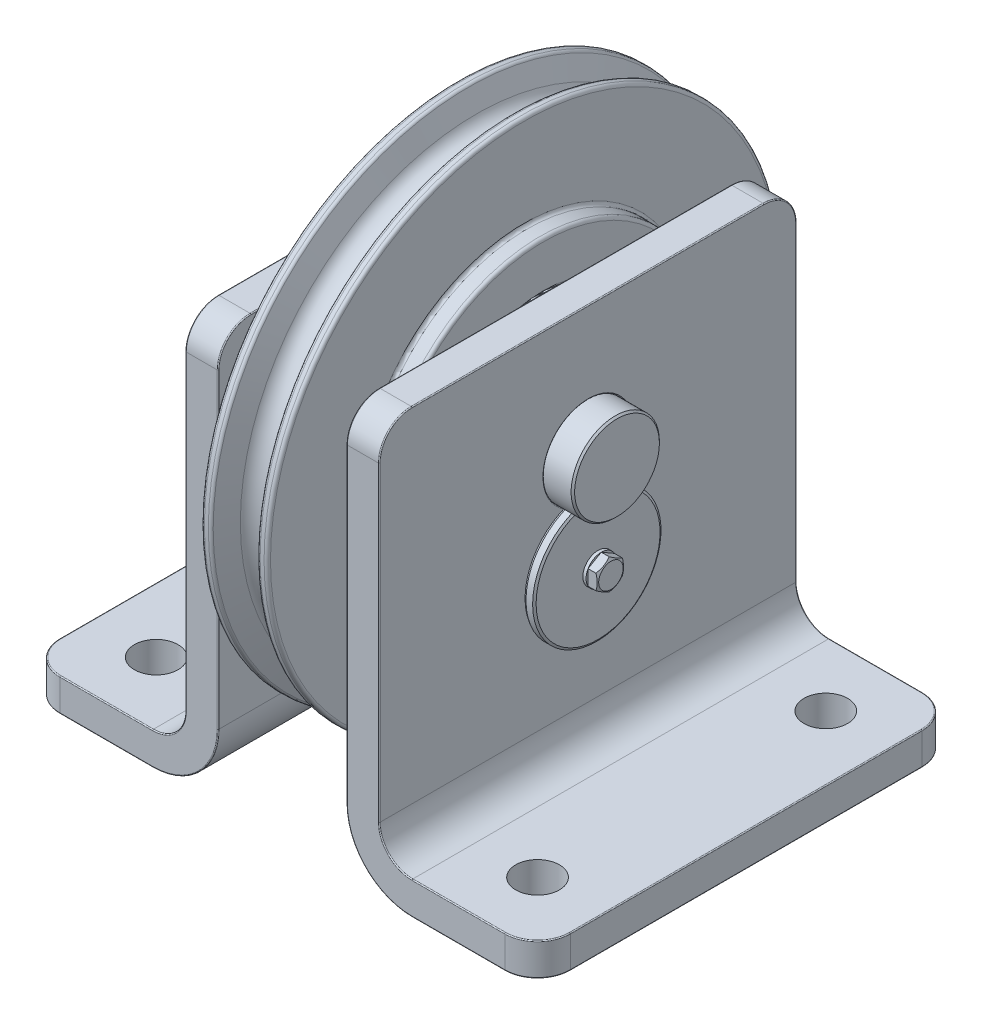
from build123d import *
from OCP.BRepFilletAPI import BRepFilletAPI_MakeChamfer

# Parameters (mm, degrees)
SKETCH5_R                       = 44.7675
CUT_EXTRUDE1_DEPTH              = 150.530082605
BOSS_EXTRUDE1_REACH             = 147.168
SKETCH6_R                       = 44.7675
BOSS_EXTRUDE1_DIRECTION_2_REACH = 147.168
BOSS_EXTRUDE2_DEPTH             = 82.55
BOSS_EXTRUDE2_DEPTH_BACK        = 82.55
FILLET1_R                       = 12.954
SKETCH8_R                       = 8.636
CUT_EXTRUDE2_DEPTH              = 247.537881116
SKETCH9_R                       = 33.866666667
BOSS_EXTRUDE3_DEPTH             = 4.699
SKETCH10_R                      = 17.4625
CUT_EXTRUDE3_DEPTH              = 164.676001653
SKETCH11_R                      = 17.4625
BOSS_EXTRUDE4_DEPTH             = 49.8602
SKETCH12_R                      = 25.4
BOSS_EXTRUDE5_DEPTH             = 4.0132
SKETCH13_W                      = 50.8
SKETCH13_H                      = 50.8
CUT_EXTRUDE4_DEPTH              = 4.0132
SKETCH14_R                      = 6.0325
BOSS_EXTRUDE6_DEPTH             = 1.27
BOSS_EXTRUDE7_DEPTH             = 3.81
SKETCH16_OUTSIDE_W              = 897.842
SKETCH16_OUTSIDE_H              = 908.256
SKETCH16_OUTSIDE_R              = 4.843298248
CUT_EXTRUDE5_DEPTH              = 180.82888058
CUT_EXTRUDE5_DRAFT              = -60
CHAMFER1_SIZE                   = 0.6985
SKETCH17_R                      = 1.27
CUT_EXTRUDE6_DEPTH              = 24.4602
CHAMFER2_SIZE                   = 0.508
CHAMFER2_SIZE2                  = 0.87988181
FILLET2_R                       = 0.381
CHAMFER3_SIZE                   = 0.254
CHAMFER3_SIZE2                  = 0.439940905
FILLET3_R                       = 1.27
CHAMFER4_SIZE                   = 0.508


with BuildPart() as part:
    # Sketch4 → Revolve1 (revolve)
    with BuildSketch(Plane.XY, mode=Mode.PRIVATE) as revolve1_sk:
        with BuildLine():
            Line((-13.081, 101.6), (-13.081, 64.0842))
            Line((-13.081, 64.0842), (-20.701, 64.0842))
            Line((-20.701, 64.0842), (-20.701, 0))
            Line((-20.701, 0), (20.701, 0))
            Line((20.701, 0), (20.701, 64.0842))
            Line((20.701, 64.0842), (13.081, 64.0842))
            Line((13.081, 64.0842), (13.081, 101.6))
            Line((13.081, 101.6), (9.41578, 101.6))
            Line((9.41578, 101.6), (5.821645932, 93.349070458))
            ThreePointArc((5.821645932, 93.349070458), (0, 89.535), (-5.821645932, 93.349070458))
            Line((-5.821645932, 93.349070458), (-9.41578, 101.6))
            Line((-9.41578, 101.6), (-13.081, 101.6))
        make_face()
    revolve(revolve1_sk.sketch.rotate(Axis((-20.701, 0, 0), (1, 0, 0)), 90), axis=Axis((-20.701, 0, 0), (1, 0, 0)))

    # Sketch5 → Cut-Extrude1 (cut, through all)
    with BuildSketch(Plane.ZY.offset(20.701)):
        Circle(SKETCH5_R)
    extrude(amount=-CUT_EXTRUDE1_DEPTH, mode=Mode.SUBTRACT)


with BuildPart() as body_2:

    # Boss-Extrude1: up to this face of the body (flat: up to its plane)
    boss_extrude1_end = Plane(part.part.faces().sort_by_distance((-20.701, 0, -62.271625105))[0])
    # Sketch6 → Boss-Extrude1 (new, up to the picked face)
    with BuildSketch(Plane(origin=(0, 0, 0), x_dir=(0, 0, -1), z_dir=(1, 0, 0)), mode=Mode.PRIVATE) as boss_extrude1_sk1:
        Circle(SKETCH6_R)
    boss_extrude1_tool1 = split(extrude(boss_extrude1_sk1.sketch, amount=-BOSS_EXTRUDE1_REACH, mode=Mode.PRIVATE), bisect_by=boss_extrude1_end, keep=Keep.BOTH, mode=Mode.PRIVATE)
    add(boss_extrude1_tool1.solids().sort_by(Axis((0, 0, 0), (-1, 0, 0)))[0])


    # Boss-Extrude1 direction 2: up to this face of the body (flat: up to its plane)
    boss_extrude1_direction_2_end = Plane(part.part.faces().sort_by_distance((20.701, 0, -62.271625105))[0])
    # Sketch6 → Boss-Extrude1 direction 2 (add, up to the picked face)
    with BuildSketch(Plane(origin=(0, 0, 0), x_dir=(0, 0, -1), z_dir=(1, 0, 0)), mode=Mode.PRIVATE) as boss_extrude1_direction_2_sk1:
        Circle(SKETCH6_R)
    boss_extrude1_direction_2_tool1 = split(extrude(boss_extrude1_direction_2_sk1.sketch, amount=BOSS_EXTRUDE1_DIRECTION_2_REACH, mode=Mode.PRIVATE), bisect_by=boss_extrude1_direction_2_end, keep=Keep.BOTH, mode=Mode.PRIVATE)
    add(boss_extrude1_direction_2_tool1.solids().sort_by(Axis((0, 0, 0), (1, 0, 0)))[0])


with BuildPart() as body_3:
    # Sketch7 → Boss-Extrude2 (new, two sides: drawn at the far end of the back side and taken through both)
    with BuildSketch(Plane.XY.offset(-BOSS_EXTRUDE2_DEPTH_BACK)):
        with BuildLine():
            Line((-25.4, 49.911), (-25.4, -86.106))
            ThreePointArc((-25.4, -86.106), (-32.988277513, -104.425722487), (-51.308, -112.014))
            Line((-51.308, -112.014), (-100.965, -112.014))
            Line((-100.965, -112.014), (-100.965, -99.06))
            Line((-100.965, -99.06), (-51.308, -99.06))
            ThreePointArc((-51.308, -99.06), (-42.148138757, -95.265861243), (-38.354, -86.106))
            Line((-38.354, -86.106), (-38.354, 49.911))
            Line((-38.354, 49.911), (-25.4, 49.911))
        make_face()
    extrude(amount=BOSS_EXTRUDE2_DEPTH + BOSS_EXTRUDE2_DEPTH_BACK)

    # Fillet1
    fillet1_edges = [body_3.edges().sort_by_distance(p)[0] for p in [
        (-100.965, -105.537, 82.55),
        (-31.877, 49.911, -82.55),
        (-100.965, -105.537, -82.55),
        (-31.877, 49.911, 82.55),
    ]]
    fillet(fillet1_edges, radius=FILLET1_R)

    # Sketch8 → Cut-Extrude2 (cut, through all)
    with BuildSketch(Plane(origin=(0, -99.06, 0), x_dir=(1, 0, 0), z_dir=(0, 1, 0))):
        with Locations(Location((-75.438, -57.023, 0), (0, 0, 270))):
            Circle(SKETCH8_R)
        with Locations(Location((-75.438, 57.023, 0), (0, 0, 270))):
            Circle(SKETCH8_R)
    extrude(amount=-CUT_EXTRUDE2_DEPTH, mode=Mode.SUBTRACT)


with BuildPart() as body_4:
    # Sketch9 → Boss-Extrude3 (new body)
    with BuildSketch(Plane.ZY.offset(20.701)):
        with Locations(Location((0, 0, 0), (0, 0, 270))):
            Circle(SKETCH9_R)
    extrude(amount=BOSS_EXTRUDE3_DEPTH)


with BuildPart() as cut_extrude3_tool:
    # Sketch10 → Cut-Extrude3 (new, through all)
    with BuildSketch(Plane.ZY.offset(38.354)):
        Circle(SKETCH10_R)
    extrude(amount=-CUT_EXTRUDE3_DEPTH)


with BuildPart() as body_2_1:
    add(body_2.part)

    # Cut-Extrude3: cut by cut_extrude3_tool
    add(cut_extrude3_tool.part, mode=Mode.SUBTRACT)

    # Chamfer4
    chamfer4_edges = [body_2_1.edges().sort_by_distance(p)[0] for p in [
        (-20.701, 0, 44.7675),
        (20.701, 0, 44.7675),
    ]]
    chamfer(chamfer4_edges, length=CHAMFER4_SIZE)


with BuildPart() as body_3_1:
    add(body_3.part)

    # Cut-Extrude3: cut by cut_extrude3_tool
    add(cut_extrude3_tool.part, mode=Mode.SUBTRACT)

    # Fillet2
    fillet2_edges = [body_3_1.edges().sort_by_distance(p)[0] for p in [
        (-42.148138757, -95.265861243, 82.55),
        (-69.6595, -99.06, 82.55),
        (-25.4, -24.5745, -82.55),
        (-32.988277513, -104.425722487, -82.55),
        (-69.6595, -99.06, -82.55),
        (-32.988277513, -104.425722487, 82.55),
        (-42.148138757, -95.265861243, -82.55),
        (-25.4, -24.5745, 82.55),
        (-100.965, -99.06, 0),
        (-100.965, -112.014, 0),
        (-69.6595, -112.014, -82.55),
        (-69.6595, -112.014, 82.55),
        (-97.170861243, -112.014, 78.755861243),
        (-97.170861243, -112.014, -78.755861243),
        (-38.354, -24.5745, -82.55),
        (-97.170861243, -99.06, 78.755861243),
        (-97.170861243, -99.06, -78.755861243),
        (-38.354, -24.5745, 82.55),
        (-38.354, 49.911, 0),
        (-38.354, 46.116861243, -78.755861243),
        (-38.354, 46.116861243, 78.755861243),
        (-25.4, 49.911, 0),
        (-25.4, 46.116861243, -78.755861243),
        (-25.4, 46.116861243, 78.755861243),
        (-38.354, 0, -17.4625),
    ]]
    fillet(fillet2_edges, radius=FILLET2_R)


with BuildPart() as body_4_1:
    add(body_4.part)

    # Cut-Extrude3: cut by cut_extrude3_tool
    add(cut_extrude3_tool.part, mode=Mode.SUBTRACT)

    # Chamfer3: one chamfer whose edges measure the first distance from different faces: ONE call of the kernel's chamfer builder (chamfer() names one face for all edges)
    chamfer3_edges_1 = [body_4_1.edges().sort_by_distance(p)[0] for p in [
        (-20.701, 33.866666667, 0),
    ]]
    chamfer3_side_1 = [body_4_1.faces().sort_by_distance(p)[0] for p in [
        (-20.701, 32.90877268, 0),
    ]]
    chamfer3_edges_2 = [body_4_1.edges().sort_by_distance(p)[0] for p in [
        (-25.4, 33.866666667, 0),
    ]]
    chamfer3_side_2 = [body_4_1.faces().sort_by_distance(p)[0] for p in [
        (-23.0505, 33.866666667, 0),
    ]]
    chamfer3 = BRepFilletAPI_MakeChamfer(body_4_1.part.solid().wrapped)
    for e in chamfer3_edges_1:
        chamfer3.Add(CHAMFER3_SIZE, CHAMFER3_SIZE2, e.wrapped, chamfer3_side_1[0].wrapped)  # the first distance lies on this face
    for e in chamfer3_edges_2:
        chamfer3.Add(CHAMFER3_SIZE, CHAMFER3_SIZE2, e.wrapped, chamfer3_side_2[0].wrapped)  # the first distance lies on this face
    add(Compound.cast(chamfer3.Shape()), mode=Mode.REPLACE)


with BuildPart() as body_5:
    # Sketch11 → Boss-Extrude4 (new, symmetric)
    with BuildSketch(Plane(origin=(0, 0, 0), x_dir=(0, 0, -1), z_dir=(1, 0, 0))):
        with Locations(Location((0, 0, 0), (0, 0, 180))):
            Circle(SKETCH11_R)
    extrude(amount=BOSS_EXTRUDE4_DEPTH, both=True)

    # Sketch13 → Cut-Extrude4 (cut)
    with BuildSketch(Plane.ZY.offset(38.354)):
        with Locations((0, -38.1)):
            Rectangle(SKETCH13_W, SKETCH13_H)
    cut_extrude4 = extrude(amount=CUT_EXTRUDE4_DEPTH, mode=Mode.SUBTRACT)

    # Mirror1: Cut-Extrude4 across plane
    add(cut_extrude4.mirror(Plane(origin=(0, 0, 0), x_dir=(0, 0, 1), z_dir=(1, 0, 0))), mode=Mode.SUBTRACT)

    # Chamfer1
    chamfer1_edges = [body_5.edges().sort_by_distance(p)[0] for p in [
        (-49.8602, 0, -17.4625),
        (49.8602, 0, -17.4625),
    ]]
    chamfer(chamfer1_edges, length=CHAMFER1_SIZE)

    # Sketch17 → Cut-Extrude6 (cut)
    with BuildSketch(Plane.ZY.offset(49.8602)):
        Circle(SKETCH17_R)
    extrude(amount=-CUT_EXTRUDE6_DEPTH, mode=Mode.SUBTRACT)


with BuildPart() as body_6:
    # Sketch12 → Boss-Extrude5 (new body)
    with BuildSketch(Plane.ZY.offset(38.354)):
        with Locations((0, -38.1)):
            Circle(SKETCH12_R)
    extrude(amount=BOSS_EXTRUDE5_DEPTH)

    # Chamfer2: one chamfer whose edges measure the first distance from different faces: ONE call of the kernel's chamfer builder (chamfer() names one face for all edges)
    chamfer2_edges_1 = [body_6.edges().sort_by_distance(p)[0] for p in [
        (-38.354, -38.1, -25.4),
    ]]
    chamfer2_side_1 = [body_6.faces().sort_by_distance(p)[0] for p in [
        (-38.354, -38.1, 0),
    ]]
    chamfer2_edges_2 = [body_6.edges().sort_by_distance(p)[0] for p in [
        (-42.3672, -38.1, -25.4),
    ]]
    chamfer2_side_2 = [body_6.faces().sort_by_distance(p)[0] for p in [
        (-40.3606, -38.1, -25.4),
    ]]
    chamfer2 = BRepFilletAPI_MakeChamfer(body_6.part.solid().wrapped)
    for e in chamfer2_edges_1:
        chamfer2.Add(CHAMFER2_SIZE, CHAMFER2_SIZE2, e.wrapped, chamfer2_side_1[0].wrapped)  # the first distance lies on this face
    for e in chamfer2_edges_2:
        chamfer2.Add(CHAMFER2_SIZE, CHAMFER2_SIZE2, e.wrapped, chamfer2_side_2[0].wrapped)  # the first distance lies on this face
    add(Compound.cast(chamfer2.Shape()), mode=Mode.REPLACE)


with BuildPart() as body_7:
    # Sketch14 → Boss-Extrude6 (new body)
    with BuildSketch(Plane.ZY.offset(42.3672)):
        with Locations((0, -38.1)):
            Circle(SKETCH14_R)
    extrude(amount=BOSS_EXTRUDE6_DEPTH)


with BuildPart() as body_8:
    # Sketch15 → Boss-Extrude7 (new body)
    with BuildSketch(Plane.ZY.offset(43.6372)):
        Polygon((5.224298248, -35.08375), (0, -32.0675), (-5.224298248, -35.08375), (-5.224298248, -41.11625), (0, -44.1325), (5.224298248, -41.11625), align=None)
    extrude(amount=BOSS_EXTRUDE7_DEPTH)


with BuildPart() as cut_extrude5_tool:
    # Sketch16 outside → Cut-Extrude5 (with draft: the straight prism first)
    with BuildSketch(Plane.ZY.offset(47.4472)):
        with Locations((0, -5.207)):
            Rectangle(SKETCH16_OUTSIDE_W, SKETCH16_OUTSIDE_H)
        with Locations((0, -38.1)):
            Circle(SKETCH16_OUTSIDE_R, mode=Mode.SUBTRACT)
    extrude(amount=-CUT_EXTRUDE5_DEPTH)
    # Cut-Extrude5: the draft: its side faces are tilted about the plane it starts from
    cut_extrude5_sides = [cut_extrude5_tool.faces().sort_by_distance(p)[0] for p in [
        (42.96724029, -459.335, 0),
        (42.96724029, -5.207, 448.921),
        (42.96724029, 448.921, 0),
        (42.96724029, -5.207, -448.921),
        (42.96724029, -38.1, -4.843298248),
    ]]
    draft(cut_extrude5_sides, Plane.ZY.offset(47.4472), CUT_EXTRUDE5_DRAFT)


with BuildPart() as body_8_1:
    add(body_8.part)

    # Cut-Extrude5: cut by cut_extrude5_tool
    add(cut_extrude5_tool.part, mode=Mode.SUBTRACT)


with BuildPart() as part_1:
    add(part.part)

    # Fillet3
    fillet3_edges = [part_1.edges().sort_by_distance(p)[0] for p in [
        (13.081, 0, -101.6),
        (13.081, 0, -64.0842),
        (20.701, 0, -64.0842),
        (-20.701, 0, -64.0842),
        (-13.081, 0, -64.0842),
        (-13.081, 0, -101.6),
        (20.701, 0, -44.7675),
        (-20.701, 0, -44.7675),
        (-9.41578, 0, -101.6),
        (9.41578, 0, -101.6),
    ]]
    fillet(fillet3_edges, radius=FILLET3_R)


with BuildPart() as body_9:
    # Mirror2: mirrored copy
    add(body_3_1.part.mirror(Plane(origin=(0, 0, 0), x_dir=(0, 0, 1), z_dir=(1, 0, 0))))


with BuildPart() as body_10:
    # Mirror2 2: mirrored copy
    add(body_8_1.part.mirror(Plane(origin=(0, 0, 0), x_dir=(0, 0, 1), z_dir=(1, 0, 0))))


with BuildPart() as body_11:
    # Mirror2 3: mirrored copy
    add(body_7.part.mirror(Plane(origin=(0, 0, 0), x_dir=(0, 0, 1), z_dir=(1, 0, 0))))


with BuildPart() as body_12:
    # Mirror2 4: mirrored copy
    add(body_6.part.mirror(Plane(origin=(0, 0, 0), x_dir=(0, 0, 1), z_dir=(1, 0, 0))))


solid = Compound([body_2_1.part, body_3_1.part, body_4_1.part, body_5.part, body_6.part, body_7.part, body_8_1.part, part_1.part, body_9.part, body_10.part, body_11.part, body_12.part])
